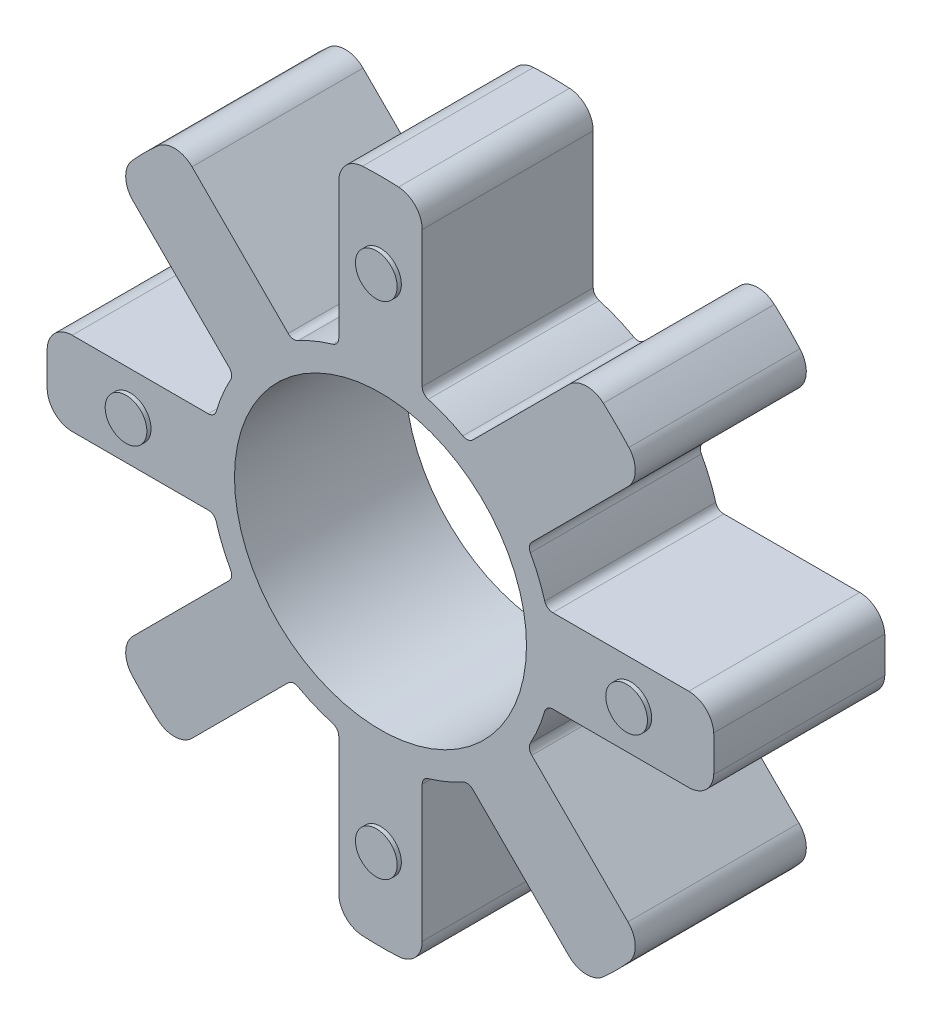
from build123d import *

# Parameters (mm, degrees)
SKETCH1_R           = 17.5
BOSS_EXTRUDE1_DEPTH = 10.25
SKETCH2_R           = 2.5
BOSS_EXTRUDE2_DEPTH = 0.5
SKETCH3_R           = 2.5
BOSS_EXTRUDE3_DEPTH = 0.5
CIRPATTERN1_COUNT   = 4


with BuildPart() as part:
    # Sketch1 → Boss-Extrude1 (new, symmetric)
    with BuildSketch(Plane.XY):
        with BuildLine():
            Line((-5, 20.645822822), (-5, 36.945906404))
            ThreePointArc((-5, 36.945906404), (-4.177898814, 39.00909732), (-2.162162162, 39.941520437))
            ThreePointArc((-2.162162162, 39.941520437), (0, 40), (2.162162162, 39.941520437))
            ThreePointArc((2.162162162, 39.941520437), (4.177898814, 39.00909732), (5, 36.945906404))
            Line((5, 36.945906404), (5, 20.645822822))
            ThreePointArc((5, 20.645822822), (5.200290751, 20.04543535), (5.720930233, 19.685551993))
            ThreePointArc((5.720930233, 19.685551993), (7.845010363, 18.939530416), (9.874478744, 17.965095868))
            ThreePointArc((9.874478744, 17.965095868), (10.497102414, 17.851424122), (11.063267415, 18.134335227))
            Line((11.063267415, 18.134335227), (22.589167049, 29.660234861))
            ThreePointArc((22.589167049, 29.660234861), (24.629376661, 30.537817825), (26.714040425, 29.771799478))
            ThreePointArc((26.714040425, 29.771799478), (28.284271247, 28.284271247), (29.771799478, 26.714040425))
            ThreePointArc((29.771799478, 26.714040425), (30.537817825, 24.629376661), (29.660234861, 22.589167049))
            Line((29.660234861, 22.589167049), (18.134335227, 11.063267415))
            ThreePointArc((18.134335227, 11.063267415), (17.851424122, 10.497102414), (17.965095868, 9.874478744))
            ThreePointArc((17.965095868, 9.874478744), (18.939530416, 7.845010363), (19.685551993, 5.720930233))
            ThreePointArc((19.685551993, 5.720930233), (20.04543535, 5.200290751), (20.645822822, 5))
            Line((20.645822822, 5), (36.945906404, 5))
            ThreePointArc((36.945906404, 5), (39.00909732, 4.177898814), (39.941520437, 2.162162162))
            ThreePointArc((39.941520437, 2.162162162), (40, 0), (39.941520437, -2.162162162))
            ThreePointArc((39.941520437, -2.162162162), (39.00909732, -4.177898814), (36.945906404, -5))
            Line((36.945906404, -5), (20.645822822, -5))
            ThreePointArc((20.645822822, -5), (20.04543535, -5.200290751), (19.685551993, -5.720930233))
            ThreePointArc((19.685551993, -5.720930233), (18.939530416, -7.845010363), (17.965095868, -9.874478744))
            ThreePointArc((17.965095868, -9.874478744), (17.851424122, -10.497102414), (18.134335227, -11.063267415))
            Line((18.134335227, -11.063267415), (29.660234861, -22.589167049))
            ThreePointArc((29.660234861, -22.589167049), (30.537817825, -24.629376661), (29.771799478, -26.714040425))
            ThreePointArc((29.771799478, -26.714040425), (28.284271247, -28.284271247), (26.714040425, -29.771799478))
            ThreePointArc((26.714040425, -29.771799478), (24.629376661, -30.537817825), (22.589167049, -29.660234861))
            Line((22.589167049, -29.660234861), (11.063267415, -18.134335227))
            ThreePointArc((11.063267415, -18.134335227), (10.497102414, -17.851424122), (9.874478744, -17.965095868))
            ThreePointArc((9.874478744, -17.965095868), (7.845010363, -18.939530416), (5.720930233, -19.685551993))
            ThreePointArc((5.720930233, -19.685551993), (5.200290751, -20.04543535), (5, -20.645822822))
            Line((5, -20.645822822), (5, -36.945906404))
            ThreePointArc((5, -36.945906404), (4.177898814, -39.00909732), (2.162162162, -39.941520437))
            ThreePointArc((2.162162162, -39.941520437), (0, -40), (-2.162162162, -39.941520437))
            ThreePointArc((-2.162162162, -39.941520437), (-4.177898814, -39.00909732), (-5, -36.945906404))
            Line((-5, -36.945906404), (-5, -20.645822822))
            ThreePointArc((-5, -20.645822822), (-5.200290751, -20.04543535), (-5.720930233, -19.685551993))
            ThreePointArc((-5.720930233, -19.685551993), (-7.845010363, -18.939530416), (-9.874478744, -17.965095868))
            ThreePointArc((-9.874478744, -17.965095868), (-10.497102414, -17.851424122), (-11.063267415, -18.134335227))
            Line((-11.063267415, -18.134335227), (-22.589167049, -29.660234861))
            ThreePointArc((-22.589167049, -29.660234861), (-24.629376661, -30.537817825), (-26.714040425, -29.771799478))
            ThreePointArc((-26.714040425, -29.771799478), (-28.284271247, -28.284271247), (-29.771799478, -26.714040425))
            ThreePointArc((-29.771799478, -26.714040425), (-30.537817825, -24.629376661), (-29.660234861, -22.589167049))
            Line((-29.660234861, -22.589167049), (-18.134335227, -11.063267415))
            ThreePointArc((-18.134335227, -11.063267415), (-17.851424122, -10.497102414), (-17.965095868, -9.874478744))
            ThreePointArc((-17.965095868, -9.874478744), (-18.939530416, -7.845010363), (-19.685551993, -5.720930233))
            ThreePointArc((-19.685551993, -5.720930233), (-20.04543535, -5.200290751), (-20.645822822, -5))
            Line((-20.645822822, -5), (-36.945906404, -5))
            ThreePointArc((-36.945906404, -5), (-39.00909732, -4.177898814), (-39.941520437, -2.162162162))
            ThreePointArc((-39.941520437, -2.162162162), (-40, 0), (-39.941520437, 2.162162162))
            ThreePointArc((-39.941520437, 2.162162162), (-39.00909732, 4.177898814), (-36.945906404, 5))
            Line((-36.945906404, 5), (-20.645822822, 5))
            ThreePointArc((-20.645822822, 5), (-20.04543535, 5.200290751), (-19.685551993, 5.720930233))
            ThreePointArc((-19.685551993, 5.720930233), (-18.939530416, 7.845010363), (-17.965095868, 9.874478744))
            ThreePointArc((-17.965095868, 9.874478744), (-17.851424122, 10.497102414), (-18.134335227, 11.063267415))
            Line((-18.134335227, 11.063267415), (-29.660234861, 22.589167049))
            ThreePointArc((-29.660234861, 22.589167049), (-30.537817825, 24.629376661), (-29.771799478, 26.714040425))
            ThreePointArc((-29.771799478, 26.714040425), (-28.284271247, 28.284271247), (-26.714040425, 29.771799478))
            ThreePointArc((-26.714040425, 29.771799478), (-24.629376661, 30.537817825), (-22.589167049, 29.660234861))
            Line((-22.589167049, 29.660234861), (-11.063267415, 18.134335227))
            ThreePointArc((-11.063267415, 18.134335227), (-10.497102414, 17.851424122), (-9.874478744, 17.965095868))
            ThreePointArc((-9.874478744, 17.965095868), (-7.845010363, 18.939530416), (-5.720930233, 19.685551993))
            ThreePointArc((-5.720930233, 19.685551993), (-5.200290751, 20.04543535), (-5, 20.645822822))
        make_face()
        Circle(SKETCH1_R, mode=Mode.SUBTRACT)
    extrude(amount=BOSS_EXTRUDE1_DEPTH, both=True)

    # Sketch2 → Boss-Extrude2 (add, symmetric)
    with BuildSketch(Plane.XY.offset(10.25)):
        with Locations(Location((0, 30, 0), (0, 0, 180))):
            Circle(SKETCH2_R)
    boss_extrude2 = extrude(amount=BOSS_EXTRUDE2_DEPTH, both=True)

    # Sketch3 → Boss-Extrude3 (add, symmetric)
    with BuildSketch(Plane(origin=(0, 0, -10.25), x_dir=(-1, 0, 0), z_dir=(0, 0, -1))):
        with Locations((-21.213203436, 21.213203436)):
            Circle(SKETCH3_R)
    boss_extrude3 = extrude(amount=BOSS_EXTRUDE3_DEPTH, both=True)

    # CirPattern1: Boss-Extrude2, Boss-Extrude3 ×4 about axis
    cirpattern1_axis = Axis((0, 0, 0), (0, 0, 1))
    add([boss_extrude2.rotate(cirpattern1_axis, i * 360 / CIRPATTERN1_COUNT) for i in range(1, CIRPATTERN1_COUNT)])
    add([boss_extrude3.rotate(cirpattern1_axis, i * 360 / CIRPATTERN1_COUNT) for i in range(1, CIRPATTERN1_COUNT)])


solid = part.part
